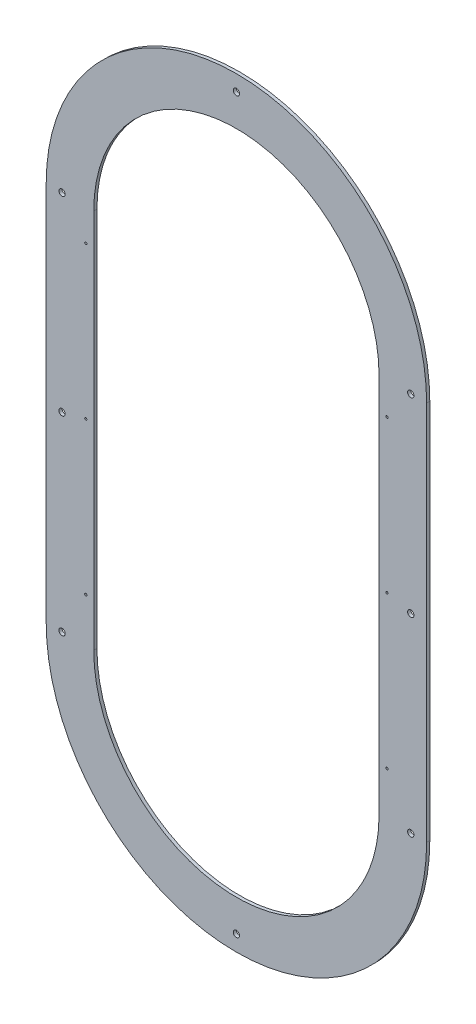
from build123d import *

# Parameters (mm, degrees)
SKETCH1_R           = 10
BOSS_EXTRUDE1_DEPTH = 10
HOLE2_D             = 7
HOLE2_CBORE_D       = 10
HOLE2_CBORE_DEPTH   = 5


with BuildPart() as part:
    # Sketch1 → Boss-Extrude1 (new body)
    with BuildSketch(Plane.XY):
        with BuildLine():
            Line((600, -600), (600, 600))
            ThreePointArc((600, 600), (0, 1200), (-600, 600))
            Line((-600, 600), (-600, -600))
            ThreePointArc((-600, -600), (0, -1200), (600, -600))
        make_face()
        with Locations((0, 1150)):
            Circle(SKETCH1_R, mode=Mode.SUBTRACT)
        with Locations((-550, 600)):
            Circle(SKETCH1_R, mode=Mode.SUBTRACT)
        with Locations((-550, 0)):
            Circle(SKETCH1_R, mode=Mode.SUBTRACT)
        with Locations((-550, -600)):
            Circle(SKETCH1_R, mode=Mode.SUBTRACT)
        with Locations((550, 600)):
            Circle(SKETCH1_R, mode=Mode.SUBTRACT)
        with Locations((550, 0)):
            Circle(SKETCH1_R, mode=Mode.SUBTRACT)
        with Locations((550, -600)):
            Circle(SKETCH1_R, mode=Mode.SUBTRACT)
        with Locations((0, -1150)):
            Circle(SKETCH1_R, mode=Mode.SUBTRACT)
        with BuildLine():
            Line((450, -600), (450, 600))
            ThreePointArc((450, 600), (0, 1050), (-450, 600))
            Line((-450, 600), (-450, -600))
            ThreePointArc((-450, -600), (0, -1050), (450, -600))
        make_face(mode=Mode.SUBTRACT)
    extrude(amount=-BOSS_EXTRUDE1_DEPTH)

    # Hole2 (through all)
    with Locations(Plane(origin=(475, 19.25, -10), x_dir=(-1, 0, 0), z_dir=(0, 0, -1))):
        with Locations((0, 0), (0, 480), (0, -480)):
            hole2 = CounterBoreHole(HOLE2_D / 2, HOLE2_CBORE_D / 2, HOLE2_CBORE_DEPTH)

    # Mirror1: Hole2 across plane
    add(hole2.mirror(Plane(origin=(0, 0, 0), x_dir=(0, 0, 1), z_dir=(1, 0, 0))), mode=Mode.SUBTRACT)


solid = part.part
